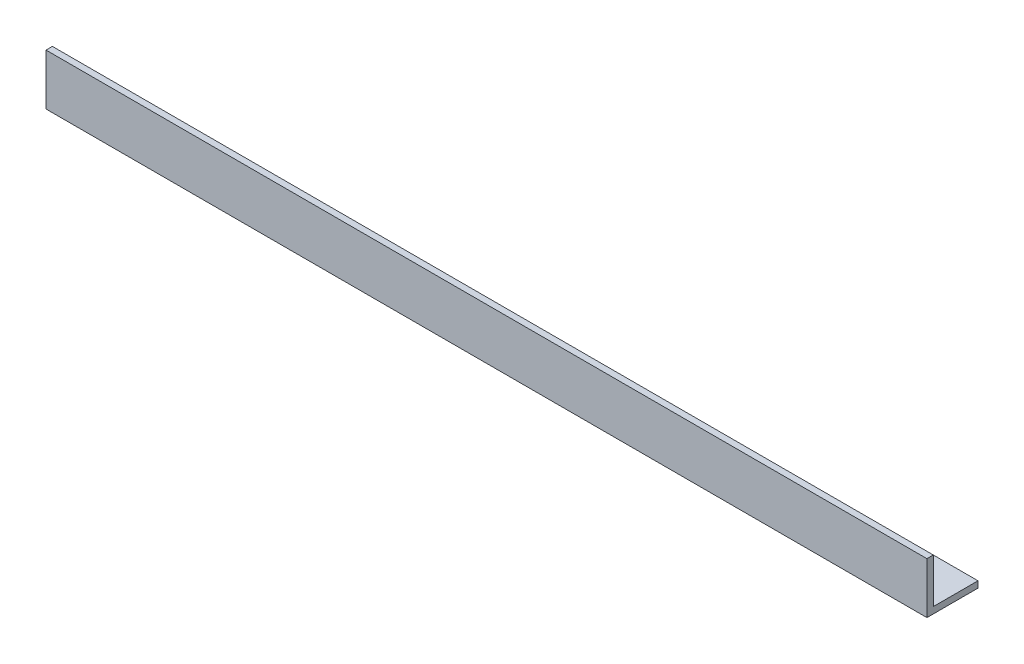
from build123d import *

# Parameters (mm, degrees)
BOSS_EXTRUDE1_DEPTH = 219.075


with BuildPart() as part:
    # Sketch2 → Boss-Extrude1 (new body)
    with BuildSketch(Plane(origin=(0, 0, 0), x_dir=(0, 0, -1), z_dir=(1, 0, 0))):
        Polygon((0, 0), (0, 12.7), (1.5875, 12.7), (1.5875, 1.5875), (12.7, 1.5875), (12.7, 0), align=None)
    extrude(amount=BOSS_EXTRUDE1_DEPTH)


solid = part.part
